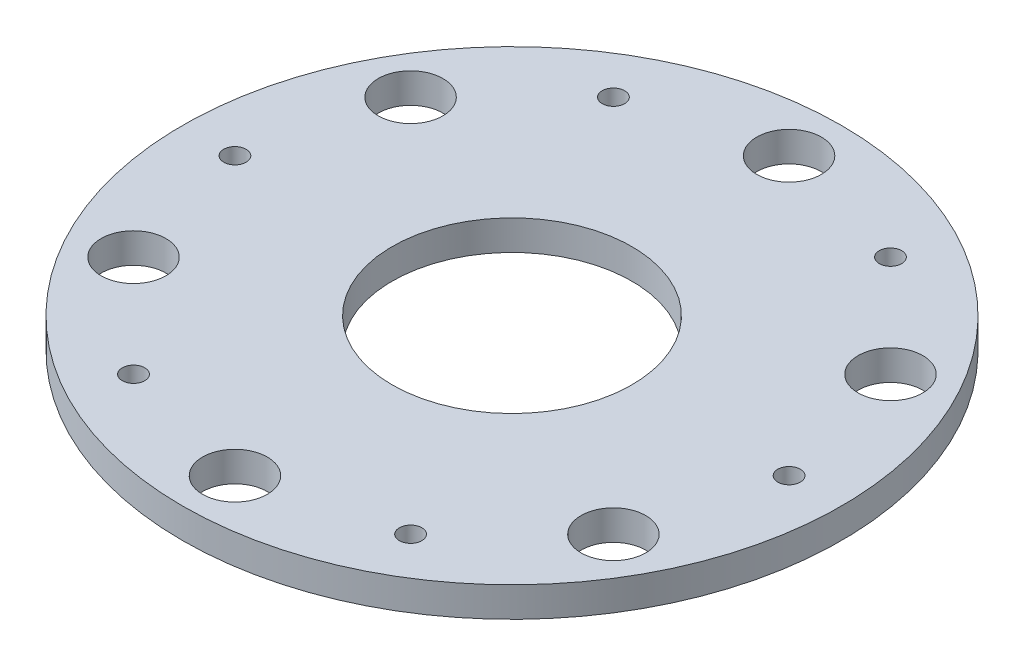
from build123d import *

# Parameters (mm, degrees)
SKETCH1_R                   = 34.925
SKETCH1_R_2                 = 12.7
SKETCH1_R_3                 = 3.429
BOSS_EXTRUDE1_DEPTH         = 3.175
TAP_DRILL_FOR_2_HELICOIL1_D = 2.38252
CIRPATTERN1_COUNT           = 6


with BuildPart() as part:
    # Sketch1 → Boss-Extrude1 (new body)
    with BuildSketch(Plane(origin=(0, 0, 0), x_dir=(1, 0, 0), z_dir=(0, 1, 0))):
        with Locations(Location((0, 0, 0), (0, 0, 270))):
            Circle(SKETCH1_R)
        with Locations(Location((0, 0, 0), (0, 0, 270))):
            Circle(SKETCH1_R_2, mode=Mode.SUBTRACT)
        with Locations(Location((0, 29.3624, 0), (0, 0, 270))):
            Circle(SKETCH1_R_3, mode=Mode.SUBTRACT)
        with Locations(Location((25.428584316, 14.6812, 0), (0, 0, 270))):
            Circle(SKETCH1_R_3, mode=Mode.SUBTRACT)
        with Locations(Location((25.428584316, -14.6812, 0), (0, 0, 270))):
            Circle(SKETCH1_R_3, mode=Mode.SUBTRACT)
        with Locations(Location((0, -29.3624, 0), (0, 0, 270))):
            Circle(SKETCH1_R_3, mode=Mode.SUBTRACT)
        with Locations(Location((-25.428584316, -14.6812, 0), (0, 0, 270))):
            Circle(SKETCH1_R_3, mode=Mode.SUBTRACT)
        with Locations(Location((-25.428584316, 14.6812, 0), (0, 0, 270))):
            Circle(SKETCH1_R_3, mode=Mode.SUBTRACT)
    extrude(amount=BOSS_EXTRUDE1_DEPTH)

    # Tap Drill for #2 Helicoil1 (through all)
    with Locations(Plane(origin=(0, 0, 0), x_dir=(-1, 0, 0), z_dir=(0, -1, 0))):
        with Locations((14.6812, 25.428584316)):
            tap_drill_for_2_helicoil1 = Hole(TAP_DRILL_FOR_2_HELICOIL1_D / 2)

    # CirPattern1: Tap Drill for #2 Helicoil1 ×6 about axis
    cirpattern1_axis = Axis((0, 0, 0), (0, 1, 0))
    for i in range(1, CIRPATTERN1_COUNT):
        add(tap_drill_for_2_helicoil1.rotate(cirpattern1_axis, i * 360 / CIRPATTERN1_COUNT), mode=Mode.SUBTRACT)


solid = part.part
